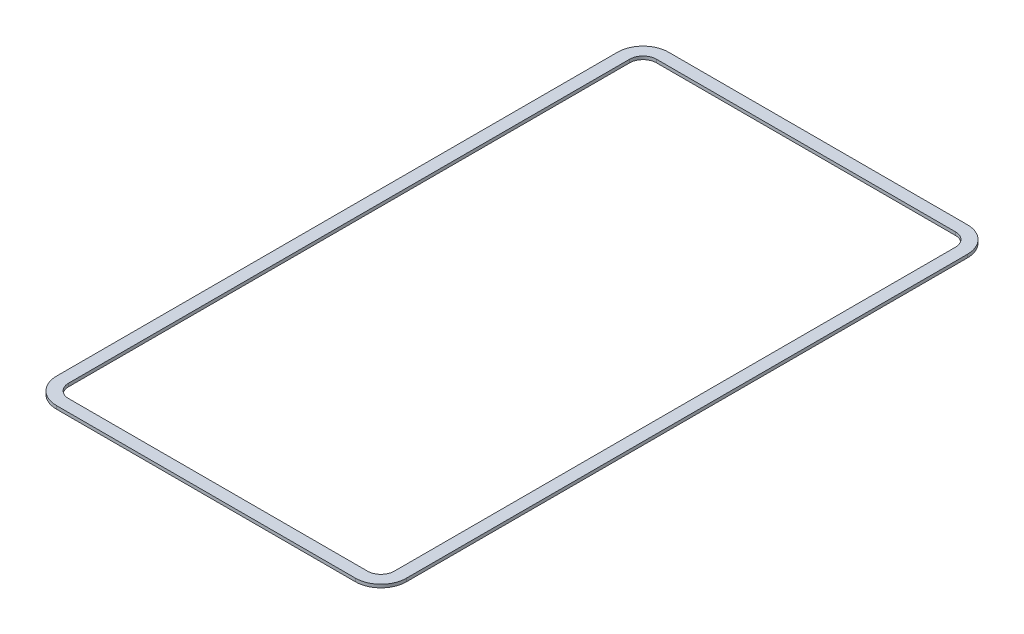
from build123d import *

# Parameters (mm, degrees)
BOSS_EXTRUDE1_DEPTH = 0.5


with BuildPart() as part:
    # Sketch1 → Boss-Extrude1 (new body)
    with BuildSketch(Plane(origin=(0, 0, 0), x_dir=(1, 0, 0), z_dir=(0, 1, 0))):
        with BuildLine():
            Line((-129.206151025, 75.504317386), (-82.319923368, 75.504317386))
            ThreePointArc((-82.319923368, 75.504317386), (-79.491496243, 74.332744511), (-78.319923368, 71.504317386))
            Line((-78.319923368, 71.504317386), (-78.319923368, -16.495682614))
            ThreePointArc((-78.319923368, -16.495682614), (-79.491496243, -19.324109739), (-82.319923368, -20.495682614))
            Line((-82.319923368, -20.495682614), (-129.206151025, -20.495682614))
            ThreePointArc((-129.206151025, -20.495682614), (-132.03457815, -19.324109739), (-133.206151025, -16.495682614))
            Line((-133.206151025, -16.495682614), (-133.206151025, 71.504317386))
            ThreePointArc((-133.206151025, 71.504317386), (-132.03457815, 74.332744511), (-129.206151025, 75.504317386))
        make_face()
        with BuildLine():
            Line((-131.306151025, 71.504317386), (-131.306151025, -16.495682614))
            ThreePointArc((-131.306151025, -16.495682614), (-130.691075266, -17.980606854), (-129.206151025, -18.595682614))
            Line((-129.206151025, -18.595682614), (-82.319923368, -18.595682614))
            ThreePointArc((-82.319923368, -18.595682614), (-80.834999127, -17.980606854), (-80.219923368, -16.495682614))
            Line((-80.219923368, -16.495682614), (-80.219923368, 71.504317386))
            ThreePointArc((-80.219923368, 71.504317386), (-80.834999127, 72.989241627), (-82.319923368, 73.604317386))
            Line((-82.319923368, 73.604317386), (-129.206151025, 73.604317386))
            ThreePointArc((-129.206151025, 73.604317386), (-130.691075266, 72.989241627), (-131.306151025, 71.504317386))
        make_face(mode=Mode.SUBTRACT)
    extrude(amount=BOSS_EXTRUDE1_DEPTH)


solid = part.part
